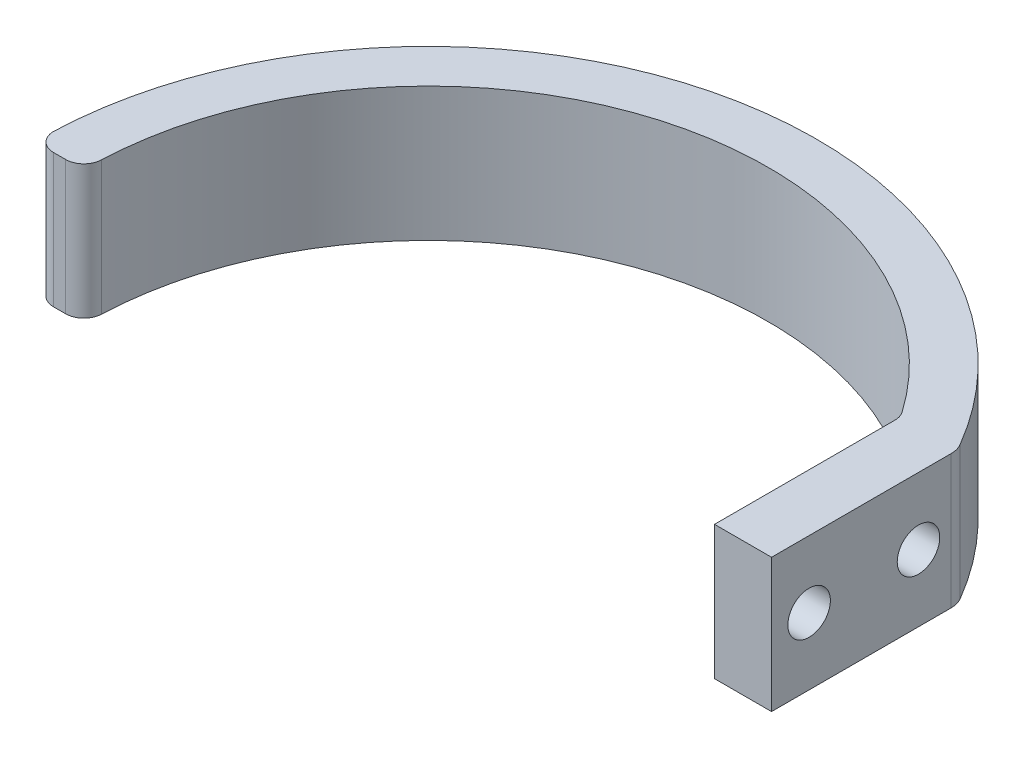
from build123d import *

# Parameters (mm, degrees)
BOSS_EXTRUDE1_DEPTH = 11
SKETCH2_W           = 8.785422424
SKETCH2_H           = 15.31
BOSS_EXTRUDE2_DEPTH = 11
CUT_EXTRUDE3_REACH  = 74.393
SKETCH3_R           = 1.75
FILLET2_R           = 1.5
FILLET4_R           = 1.5
CUT_EXTRUDE4_REACH  = 48.571
SKETCH5_W           = 4.090875198
SKETCH5_H           = 15.31
FILLET6_R           = 2


with BuildPart() as part:
    # Sketch1 → Boss-Extrude1 (new body)
    with BuildSketch(Plane(origin=(0, 0, 0), x_dir=(1, 0, 0), z_dir=(0, 1, 0))):
        with BuildLine():
            Line((-31.998102942, -0.348436693), (-27.998102942, -0.348436693))
            ThreePointArc((-27.998102942, -0.348436693), (-0.348436693, 27.998102942), (27.998102942, 0.348436693))
            Line((27.998102942, 0.348436693), (31.998102942, 0.348436693))
            ThreePointArc((31.998102942, 0.348436693), (-0.348436693, 31.998102942), (-31.998102942, -0.348436693))
        make_face()
    extrude(amount=BOSS_EXTRUDE1_DEPTH)

    # Sketch2 → Boss-Extrude2 (add, through all)
    with BuildSketch(Plane(origin=(0, 11, 0), x_dir=(1, 0, 0), z_dir=(0, 1, 0))):
        with Locations((27.60539173, 8.003436693)):
            Rectangle(SKETCH2_W, SKETCH2_H)
    extrude(amount=-BOSS_EXTRUDE2_DEPTH)

    # Sketch3 → Cut-Extrude3 (cut, up to next)
    with BuildSketch(Plane(origin=(31.998102942, 0, 0), x_dir=(0, 0, -1), z_dir=(1, 0, 0)), mode=Mode.PRIVATE) as cut_extrude3_sk1:
        with Locations((3.439433815, 5.5)):
            Circle(SKETCH3_R)
    cut_extrude3_tool1 = extrude(cut_extrude3_sk1.sketch, amount=-CUT_EXTRUDE3_REACH, mode=Mode.PRIVATE) & part.part
    # Sketch3 → Cut-Extrude3 (cut, up to next)
    with BuildSketch(Plane(origin=(31.998102942, 0, 0), x_dir=(0, 0, -1), z_dir=(1, 0, 0)), mode=Mode.PRIVATE) as cut_extrude3_sk2:
        with Locations((12.439433815, 5.5)):
            Circle(SKETCH3_R)
    cut_extrude3_tool2 = extrude(cut_extrude3_sk2.sketch, amount=-CUT_EXTRUDE3_REACH, mode=Mode.PRIVATE) & part.part
    add(cut_extrude3_tool1.solids().sort_by_distance((31.998103, 5.5, -3.439434))[0], mode=Mode.SUBTRACT)
    add(cut_extrude3_tool2.solids().sort_by_distance((31.998103, 5.5, -12.439434))[0], mode=Mode.SUBTRACT)

    # Fillet2
    fillet2_edges = [part.edges().sort_by_distance(p)[0] for p in [
        (23.212680518, 5.5, -15.658436693),
    ]]
    fillet(fillet2_edges, radius=FILLET2_R)

    # Fillet4
    fillet4_edges = [part.edges().sort_by_distance(p)[0] for p in [
        (-31.998102942, 5.5, 0.348436693),
        (-27.998102942, 5.5, 0.348436693),
    ]]
    fillet(fillet4_edges, radius=FILLET4_R)

    # Sketch5 → Cut-Extrude4 (cut, up to next)
    with BuildSketch(Plane(origin=(0, 11, 0), x_dir=(1, 0, 0), z_dir=(0, 1, 0)), mode=Mode.PRIVATE) as cut_extrude4_sk1:
        with Locations((29.952665343, 8.003436693)):
            Rectangle(SKETCH5_W, SKETCH5_H)
    cut_extrude4_tool1 = extrude(cut_extrude4_sk1.sketch, amount=-CUT_EXTRUDE4_REACH, mode=Mode.PRIVATE) & part.part
    add(cut_extrude4_tool1.solids().sort_by_distance((29.952665, 11, -8.003437))[0], mode=Mode.SUBTRACT)

    # Fillet6
    fillet6_edges = [part.edges().sort_by_distance(p)[0] for p in [
        (27.907227744, 5.5, -15.658436693),
    ]]
    fillet(fillet6_edges, radius=FILLET6_R)


solid = part.part
